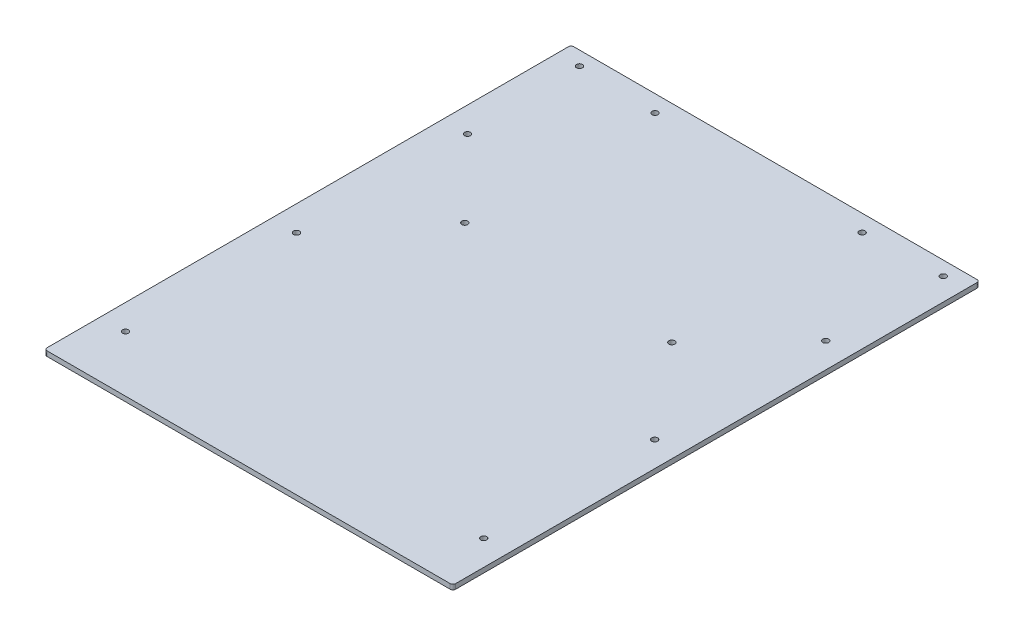
from build123d import *

# Parameters (mm, degrees)
SKETCH1_W           = 463.55
SKETCH1_H           = 597.662
SKETCH1_R           = 3.3782
BOSS_EXTRUDE1_DEPTH = 5.588
FILLET1_R           = 3.175
SKETCH2_R           = 3.3782
CUT_EXTRUDE1_DEPTH  = 757.379332404
SKETCH3_R           = 3.3782
CUT_EXTRUDE2_DEPTH  = 757.379332404


with BuildPart() as part:
    # Sketch1 → Boss-Extrude1 (new body)
    with BuildSketch(Plane(origin=(0, 0, 0), x_dir=(1, 0, 0), z_dir=(0, 1, 0))):
        with Locations((231.775, 298.831)):
            Rectangle(SKETCH1_W, SKETCH1_H)
        with Locations(Location((28.575, 63.5, 0), (0, 0, 270))):
            Circle(SKETCH1_R, mode=Mode.SUBTRACT)
        with Locations(Location((28.575, 257.556, 0), (0, 0, 270))):
            Circle(SKETCH1_R, mode=Mode.SUBTRACT)
        with Locations(Location((28.575, 451.612, 0), (0, 0, 270))):
            Circle(SKETCH1_R, mode=Mode.SUBTRACT)
        with Locations(Location((434.975, 451.612, 0), (0, 0, 90))):
            Circle(SKETCH1_R, mode=Mode.SUBTRACT)
        with Locations(Location((434.975, 257.556, 0), (0, 0, 90))):
            Circle(SKETCH1_R, mode=Mode.SUBTRACT)
        with Locations(Location((434.975, 63.5, 0), (0, 0, 90))):
            Circle(SKETCH1_R, mode=Mode.SUBTRACT)
    extrude(amount=BOSS_EXTRUDE1_DEPTH)

    # Fillet1
    fillet1_edges = [part.edges().sort_by_distance(p)[0] for p in [
        (0, 2.794, -597.662),
        (463.55, 2.794, -597.662),
        (463.55, 2.794, 0),
        (0, 2.794, 0),
    ]]
    fillet(fillet1_edges, radius=FILLET1_R)

    # Sketch2 → Cut-Extrude1 (cut, through all)
    with BuildSketch(Plane(origin=(0, 5.588, 0), x_dir=(1, 0, 0), z_dir=(0, 1, 0))):
        with Locations(Location((25.4, 581.787, 0), (0, 0, 270))):
            Circle(SKETCH2_R)
        with Locations(Location((438.15, 581.787, 0), (0, 0, 90))):
            Circle(SKETCH2_R)
    extrude(amount=-CUT_EXTRUDE1_DEPTH, mode=Mode.SUBTRACT)

    # Sketch3 → Cut-Extrude2 (cut, through all)
    with BuildSketch(Plane(origin=(0, 5.588, 0), x_dir=(1, 0, 0), z_dir=(0, 1, 0))):
        with Locations(Location((114.3, 578.612, 0), (0, 0, 270))):
            Circle(SKETCH3_R)
        with Locations(Location((349.25, 578.612, 0), (0, 0, 270))):
            Circle(SKETCH3_R)
        with Locations(Location((114.3, 362.712, 0), (0, 0, 270))):
            Circle(SKETCH3_R)
        with Locations(Location((349.25, 362.712, 0), (0, 0, 270))):
            Circle(SKETCH3_R)
    extrude(amount=-CUT_EXTRUDE2_DEPTH, mode=Mode.SUBTRACT)


solid = part.part
